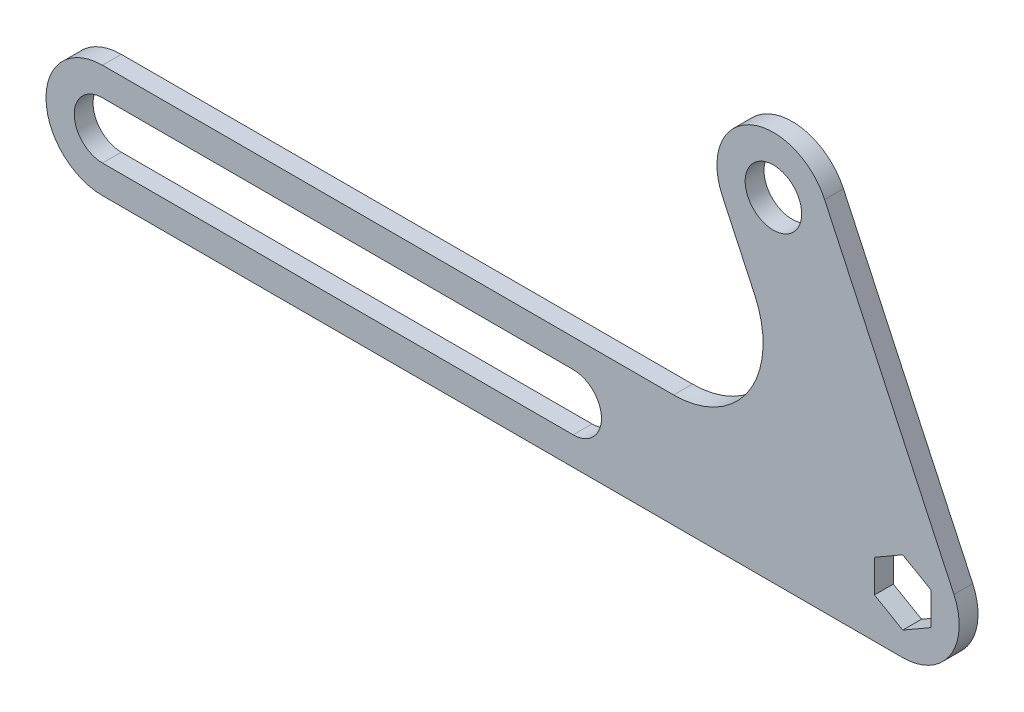
from build123d import *

# Parameters (mm, degrees)
SKETCH1_R           = 6
BOSS_EXTRUDE1_DEPTH = 4


with BuildPart() as part:
    # Sketch1 → Boss-Extrude1 (new body)
    with BuildSketch(Plane.XY):
        with BuildLine():
            Line((0, 0), (170, 0))
            ThreePointArc((170, 0), (180.12069735, 5.5524047), (180.875693444, 17.071419141))
            Line((180.875693444, 17.071419141), (153.405506431, 75.981425298))
            ThreePointArc((153.405506431, 75.981425298), (137.458393846, 81.785699602), (131.654119542, 65.838587016))
            Line((131.654119542, 65.838587016), (138.559595063, 51.029746973))
            ThreePointArc((138.559595063, 51.029746973), (137.36418458, 32.791307441), (121.339747109, 24))
            Line((121.339747109, 24), (0, 24))
            ThreePointArc((0, 24), (-12, 12), (0, 0))
        make_face()
        with Locations((142.529812987, 70.910006157)):
            Circle(SKETCH1_R, mode=Mode.SUBTRACT)
        with BuildLine():
            Line((0, 18), (100, 18))
            ThreePointArc((100, 18), (106, 12), (100, 6))
            Line((100, 6), (0, 6))
            ThreePointArc((0, 6), (-6, 12), (0, 18))
        make_face(mode=Mode.SUBTRACT)
        Polygon((170, 18.92820323), (164, 15.464101615), (164, 8.535898385), (170, 5.07179677), (176, 8.535898385), (176, 15.464101615), align=None, mode=Mode.SUBTRACT)
    extrude(amount=BOSS_EXTRUDE1_DEPTH)


solid = part.part
